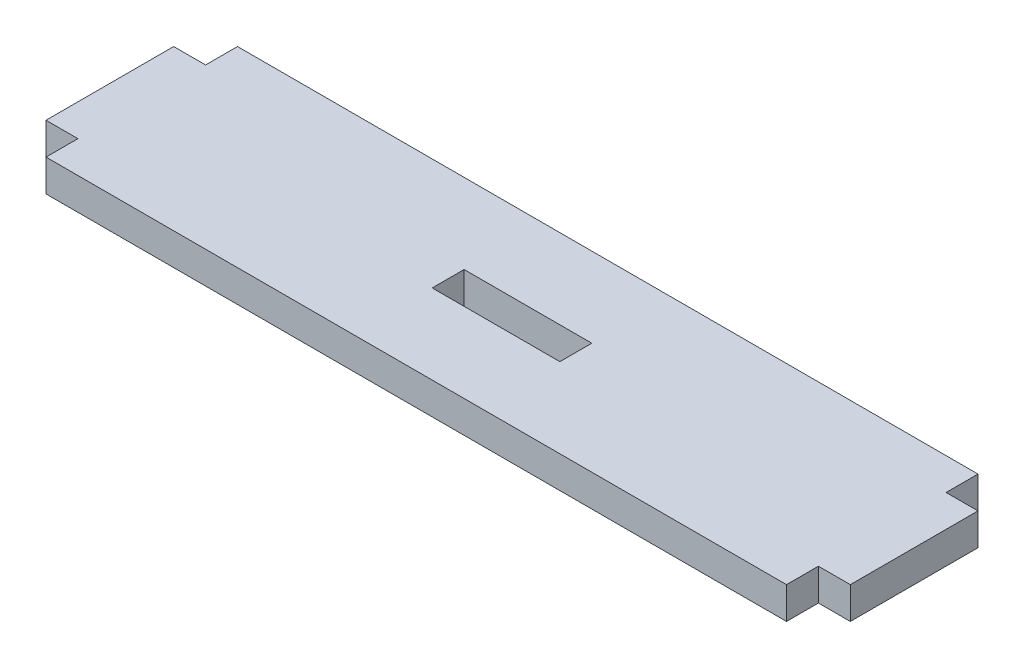
from build123d import *

# Parameters (mm, degrees)
SKETCH2_W           = 20
SKETCH2_H           = 5
BOSS_EXTRUDE1_DEPTH = 5


with BuildPart() as part:
    # Sketch2 → Boss-Extrude1 (new body)
    with BuildSketch(Plane(origin=(0, 0, 0), x_dir=(1, 0, 0), z_dir=(0, 1, 0))):
        Polygon((46.589298205, 13.308977097), (51.589298205, 13.308977097), (95.089298205, 13.308977097), (95.089298205, 8.308977097), (100.089298205, 8.308977097), (100.089298205, -11.691022903), (95.089298205, -11.691022903), (95.089298205, -16.691022903), (-20.910701795, -16.691022903), (-20.910701795, -11.691022903), (-25.910701795, -11.691022903), (-25.910701795, 8.308977097), (-20.910701795, 8.308977097), (-20.910701795, 13.308977097), (22.589298205, 13.308977097), (27.589298205, 13.308977097), align=None)
        with Locations((37.089298205, -1.691022903)):
            Rectangle(SKETCH2_W, SKETCH2_H, mode=Mode.SUBTRACT)
    extrude(amount=BOSS_EXTRUDE1_DEPTH)


solid = part.part
